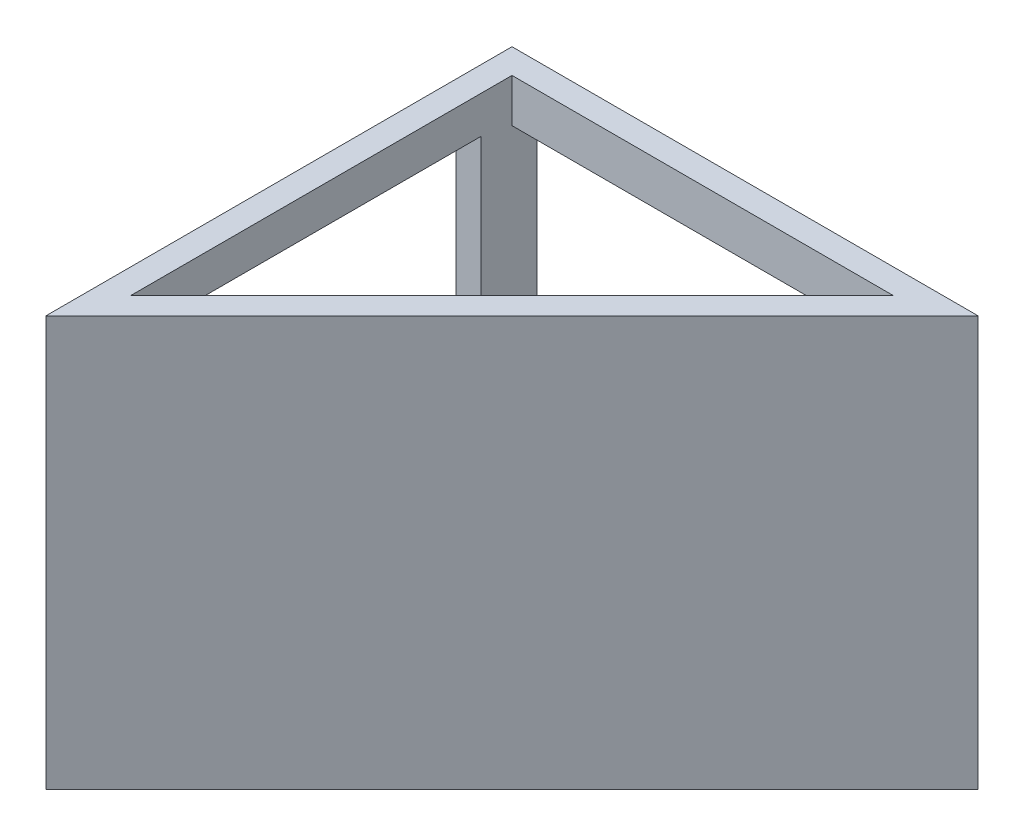
from build123d import *

# Parameters (mm, degrees)
BOSS_EXTRUDE1_DEPTH = 33
BOSS_EXTRUDE2_DEPTH = 2
SKETCH3_W           = 29
SKETCH3_H           = 26.5
CUT_EXTRUDE1_DEPTH  = 2
SKETCH4_W           = 28.5
SKETCH4_H           = 25
CUT_EXTRUDE2_DEPTH  = 2


with BuildPart() as part:
    # Sketch1 → Boss-Extrude1 (new body)
    with BuildSketch(Plane(origin=(0, 0, 0), x_dir=(1, 0, 0), z_dir=(0, 1, 0))):
        Polygon((0, 0), (37.5, 0), (0, -37.5), align=None)
        Polygon((2, -2), (32.671572875, -2), (2, -32.671572875), align=None, mode=Mode.SUBTRACT)
    extrude(amount=BOSS_EXTRUDE1_DEPTH)

    # Sketch2 → Boss-Extrude2 (add)
    with BuildSketch(Plane.XZ):
        Polygon((2, 32.671572875), (32.671572875, 2), (2, 2), align=None)
    extrude(amount=-BOSS_EXTRUDE2_DEPTH)

    # Sketch3 → Cut-Extrude1 (cut)
    with BuildSketch(Plane(origin=(0, 0, 0), x_dir=(-1, 0, 0), z_dir=(0, 0, -1))):
        with Locations((-16.5, 16.25)):
            Rectangle(SKETCH3_W, SKETCH3_H)
    extrude(amount=-CUT_EXTRUDE1_DEPTH, mode=Mode.SUBTRACT)

    # Sketch4 → Cut-Extrude2 (cut)
    with BuildSketch(Plane.ZY):
        with Locations((18.75, 17.5)):
            Rectangle(SKETCH4_W, SKETCH4_H)
    extrude(amount=-CUT_EXTRUDE2_DEPTH, mode=Mode.SUBTRACT)


solid = part.part
